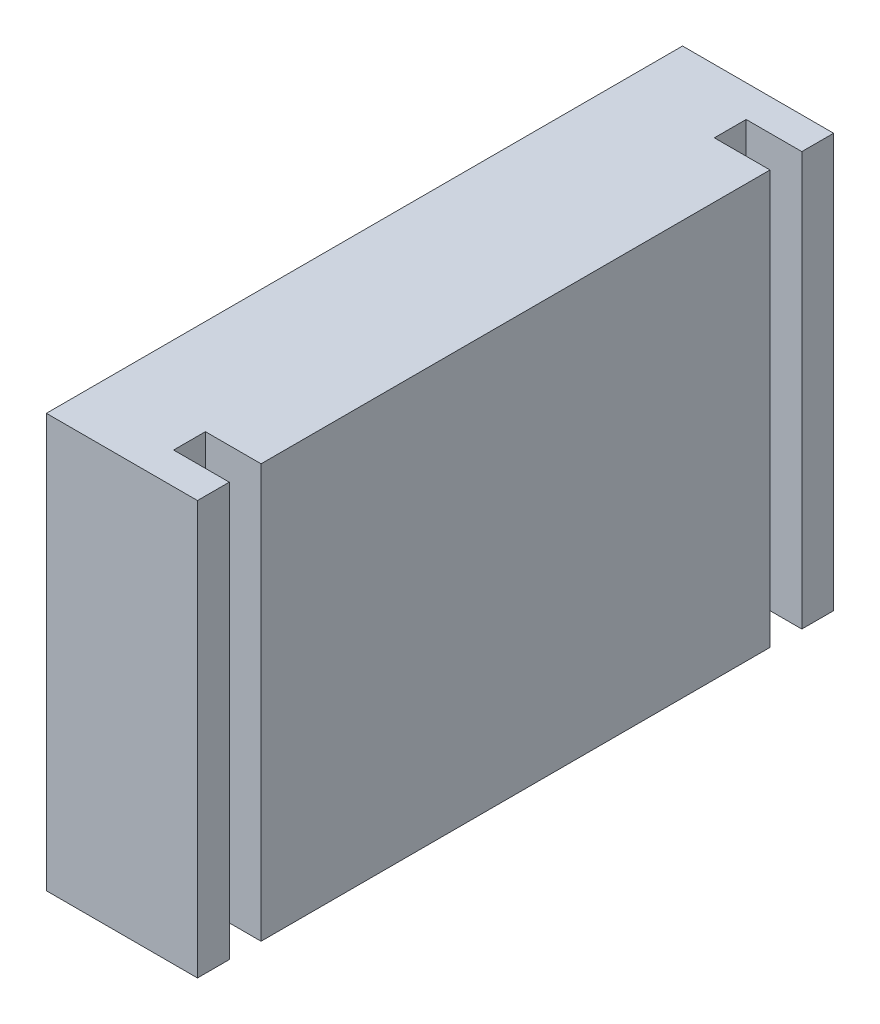
from build123d import *

# Parameters (mm, degrees)
SALIENTE_EXTRUIR3_DEPTH = 10
CROQUIS4_W              = 20
CROQUIS4_H              = 5
SALIENTE_EXTRUIR4_DEPTH = 10
CROQUIS5_W              = 5
CROQUIS5_H              = 5
SALIENTE_EXTRUIR5_DEPTH = 20
CORTAR_EXTRUIR1_DEPTH   = 2
CROQUIS8_W              = 20
CROQUIS8_H              = 5
CORTAR_EXTRUIR2_DEPTH   = 2
CROQUIS9_W              = 5
CROQUIS9_H              = 20
CORTAR_EXTRUIR3_DEPTH   = 2
CROQUIS10_W             = 20
CROQUIS10_H             = 5
CORTAR_EXTRUIR5_DEPTH   = 35
SALIENTE_EXTRUIR6_DEPTH = 5
CROQUIS12_W             = 26.103344273
CROQUIS12_H             = 18.453448341
CORTAR_EXTRUIR6_DEPTH   = 0.25


with BuildPart() as part:
    # Croquis1 → Saliente-Extruir3 (new body)
    with BuildSketch(Plane(origin=(0, 0, 0), x_dir=(1, 0, 0), z_dir=(0, 1, 0))):
        Polygon((-12.713671106, 38.358548308), (-10.713671106, 38.358548308), (-10.713671106, 39.358548308), (-15.713671106, 39.358548308), (-15.713671106, 19.358548308), (-10.713671106, 19.358548308), (-10.713671106, 20.358548308), (-12.713671106, 20.358548308), (-12.713671106, 21.358548308), (-10.718625385, 21.358548308), (-10.718625385, 37.358548308), (-12.713671106, 37.358548308), align=None)
    extrude(amount=SALIENTE_EXTRUIR3_DEPTH)



with BuildPart() as body_2:
    # Croquis4 → Saliente-Extruir4 (new body)
    with BuildSketch(Plane(origin=(-10.713671106, 0, 0), x_dir=(0, 0, -1), z_dir=(1, 0, 0))):
        with Locations((29.358548308, -2.5)):
            Rectangle(CROQUIS4_W, CROQUIS4_H)
    extrude(amount=SALIENTE_EXTRUIR4_DEPTH)


with BuildPart() as part_1:
    add(part.part)

    add(body_2.part)  # Saliente-Extruir5 merges body 2
    # Croquis5 → Saliente-Extruir5 (add)
    with BuildSketch(Plane.XY.offset(-19.358548308)):
        with Locations((-13.213671106, -2.5)):
            Rectangle(CROQUIS5_W, CROQUIS5_H)
    extrude(amount=-SALIENTE_EXTRUIR5_DEPTH)

    # Croquis7 → Cortar-Extruir1 (cut)
    with BuildSketch(Plane(origin=(0, 0, 0), x_dir=(1, 0, 0), z_dir=(0, 1, 0))):
        Polygon((-10.714909676, 37.358548308), (-0.713671106, 37.358548308), (-0.713671106, 38.358548308), (-10.713671106, 38.358548308), (-12.713671106, 38.358548308), (-12.713671106, 37.358548308), align=None)
        Polygon((-10.713671106, 20.358548308), (-0.713671106, 20.358548308), (-0.713671106, 21.358548308), (-10.714909676, 21.358548308), (-12.713671106, 21.358548308), (-12.713671106, 20.358548308), align=None)
    extrude(amount=-CORTAR_EXTRUIR1_DEPTH, mode=Mode.SUBTRACT)

    # Croquis8 → Cortar-Extruir2 (cut)
    with BuildSketch(Plane(origin=(-0.713671106, 0, 0), x_dir=(0, 0, -1), z_dir=(1, 0, 0))):
        with Locations((29.358548308, -2.5)):
            Rectangle(CROQUIS8_W, CROQUIS8_H)
    extrude(amount=-CORTAR_EXTRUIR2_DEPTH, mode=Mode.SUBTRACT)

    # Croquis9 → Cortar-Extruir3 (cut)
    with BuildSketch(Plane(origin=(0, 10, 0), x_dir=(1, 0, 0), z_dir=(0, 1, 0))):
        with Locations((-13.213671106, 29.358548308)):
            Rectangle(CROQUIS9_W, CROQUIS9_H)
    extrude(amount=-CORTAR_EXTRUIR3_DEPTH, mode=Mode.SUBTRACT)

    # Croquis10 → Cortar-Extruir5 (cut)
    with BuildSketch(Plane(origin=(-2.713671106, 0, 0), x_dir=(0, 0, -1), z_dir=(1, 0, 0))):
        with Locations((29.358548308, -2.5)):
            Rectangle(CROQUIS10_W, CROQUIS10_H)
    extrude(amount=-CORTAR_EXTRUIR5_DEPTH, mode=Mode.SUBTRACT)

    # Croquis11 → Saliente-Extruir6 (add)
    with BuildSketch(Plane.XZ):
        Polygon((-10.713671106, -20.358548308), (-10.713671106, -19.358548308), (-15.713671106, -19.358548308), (-15.713671106, -39.358548308), (-10.713671106, -39.358548308), (-10.713671106, -38.358548308), (-12.713671106, -38.358548308), (-12.713671106, -37.358548308), (-10.716767531, -37.358548308), (-10.717696458, -21.358548308), (-12.713671106, -21.358548308), (-12.713671106, -20.358548308), align=None)
    extrude(amount=SALIENTE_EXTRUIR6_DEPTH)

    # Croquis12 → Cortar-Extruir6 (cut)
    with BuildSketch(Plane(origin=(-10.713671106, 0, 0), x_dir=(0, 0, -1), z_dir=(1, 0, 0))):
        with Locations((28.040672231, 2.092138624)):
            Rectangle(CROQUIS12_W, CROQUIS12_H)
    extrude(amount=-CORTAR_EXTRUIR6_DEPTH, mode=Mode.SUBTRACT)


solid = part_1.part
